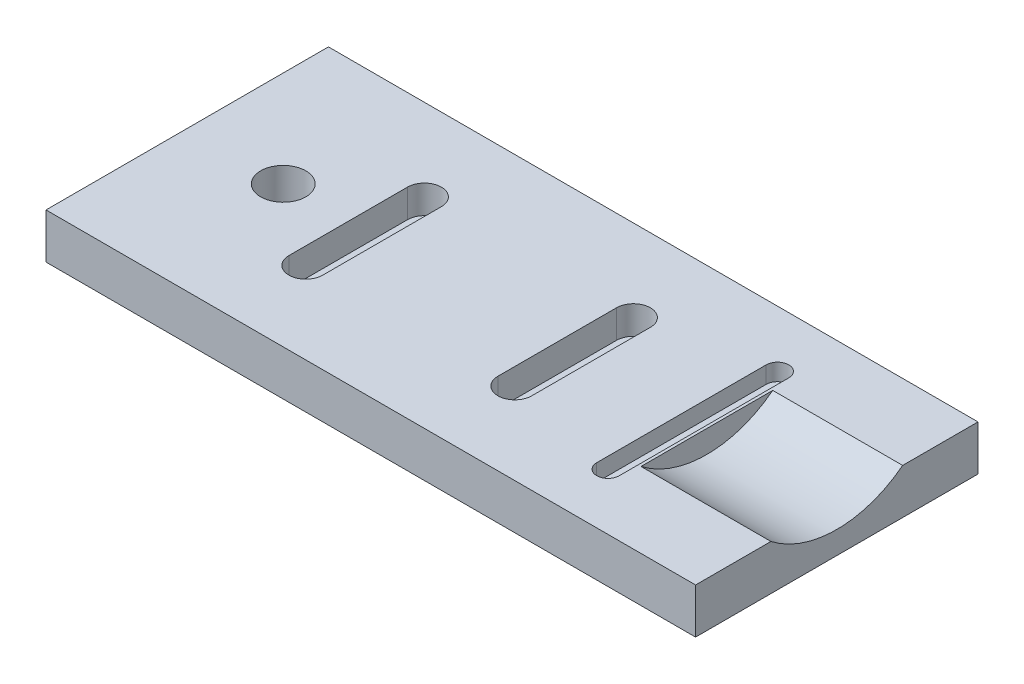
from build123d import *

# Parameters (mm, degrees)
SKETCH1_W           = 115
SKETCH1_H           = 50
BOSS_EXTRUDE1_DEPTH = 8
SKETCH2_R           = 4
CUT_EXTRUDE1_DEPTH  = 10
CUT_EXTRUDE2_DEPTH  = 5
LPATTERN1_COUNT     = 2
LPATTERN1_PITCH     = 37
CUT_EXTRUDE3_DEPTH  = 3
CUT_EXTRUDE4_DEPTH  = 23
CUT_EXTRUDE8_DEPTH  = 5
CUT_EXTRUDE9_DEPTH  = 5


with BuildPart() as part:
    # Sketch1 → Boss-Extrude1 (new body)
    with BuildSketch(Plane(origin=(0, 0, 0), x_dir=(1, 0, 0), z_dir=(0, 1, 0))):
        Rectangle(SKETCH1_W, SKETCH1_H)
    extrude(amount=BOSS_EXTRUDE1_DEPTH)

    # Sketch2 → Cut-Extrude1 (cut)
    with BuildSketch(Plane(origin=(0, 8, 0), x_dir=(1, 0, 0), z_dir=(0, 1, 0))):
        with Locations(Location((-40.5, 0, 0), (0, 0, 270))):
            Circle(SKETCH2_R)
    extrude(amount=-CUT_EXTRUDE1_DEPTH, mode=Mode.SUBTRACT)

    # Sketch3 → Cut-Extrude2 (cut)
    with BuildSketch(Plane(origin=(0, 8, 0), x_dir=(1, 0, 0), z_dir=(0, 1, 0))):
        with BuildLine():
            Line((-29, -10.5), (-29, 10.5))
            ThreePointArc((-29, 10.5), (-26, 13.5), (-23, 10.5))
            Line((-23, 10.5), (-23, -10.5))
            ThreePointArc((-23, -10.5), (-26, -13.5), (-29, -10.5))
        make_face()
    cut_extrude2 = extrude(amount=-CUT_EXTRUDE2_DEPTH, mode=Mode.SUBTRACT)

    # LPattern1: Cut-Extrude2 ×2
    with Locations(*[(i * LPATTERN1_PITCH, 0, 0) for i in range(1, LPATTERN1_COUNT)]):
        add(cut_extrude2, mode=Mode.SUBTRACT)

    # Sketch4 → Cut-Extrude3 (cut)
    with BuildSketch(Plane(origin=(0, 8, 0), x_dir=(1, 0, 0), z_dir=(0, 1, 0))):
        with BuildLine():
            Line((34, 15), (34, -15))
            ThreePointArc((34, -15), (32, -17), (30, -15))
            Line((30, -15), (30, 15))
            ThreePointArc((30, 15), (32, 17), (34, 15))
        make_face()
    extrude(amount=-CUT_EXTRUDE3_DEPTH, mode=Mode.SUBTRACT)

    # Sketch5 → Cut-Extrude4 (cut)
    with BuildSketch(Plane(origin=(57.5, 0, 0), x_dir=(0, 0, -1), z_dir=(1, 0, 0))):
        with BuildLine():
            Line((11.66190379, 8), (0, 23))
            Line((0, 23), (-11.66190379, 8))
            ThreePointArc((-11.66190379, 8), (0, 4), (11.66190379, 8))
        make_face()
    extrude(amount=-CUT_EXTRUDE4_DEPTH, mode=Mode.SUBTRACT)

    # Sketch9 → Cut-Extrude8 (cut)
    with BuildSketch(Plane.XZ):
        with BuildLine():
            Line((-8.787415011, 3.25), (-6.212584989, 3.25))
            ThreePointArc((-6.212584989, 3.25), (-4.573205347, 2.926794653), (-4.25, 1.287415011))
            Line((-4.25, 1.287415011), (-4.25, -1.287415011))
            ThreePointArc((-4.25, -1.287415011), (-4.573205347, -2.926794653), (-6.212584989, -3.25))
            Line((-6.212584989, -3.25), (-8.787415011, -3.25))
            ThreePointArc((-8.787415011, -3.25), (-10.426794653, -2.926794653), (-10.75, -1.287415011))
            Line((-10.75, -1.287415011), (-10.75, 1.287415011))
            ThreePointArc((-10.75, 1.287415011), (-10.426794653, 2.926794653), (-8.787415011, 3.25))
        make_face()
    extrude(amount=-CUT_EXTRUDE8_DEPTH, mode=Mode.SUBTRACT)

    # Sketch10 → Cut-Extrude9 (cut)
    with BuildSketch(Plane.XZ):
        with BuildLine():
            ThreePointArc((2.399494937, 9.899494937), (-20.434313455, 5.357568053), (-7.5, -14))
            ThreePointArc((-7.5, -14), (-5.5, -12), (-7.5, -10))
            ThreePointArc((-7.5, -10), (-16.738795325, 3.826834324), (-0.428932188, 7.071067812))
            ThreePointArc((-0.428932188, 7.071067812), (2.399494937, 7.071067812), (2.399494937, 9.899494937))
        make_face()
    extrude(amount=-CUT_EXTRUDE9_DEPTH, mode=Mode.SUBTRACT)


solid = part.part
